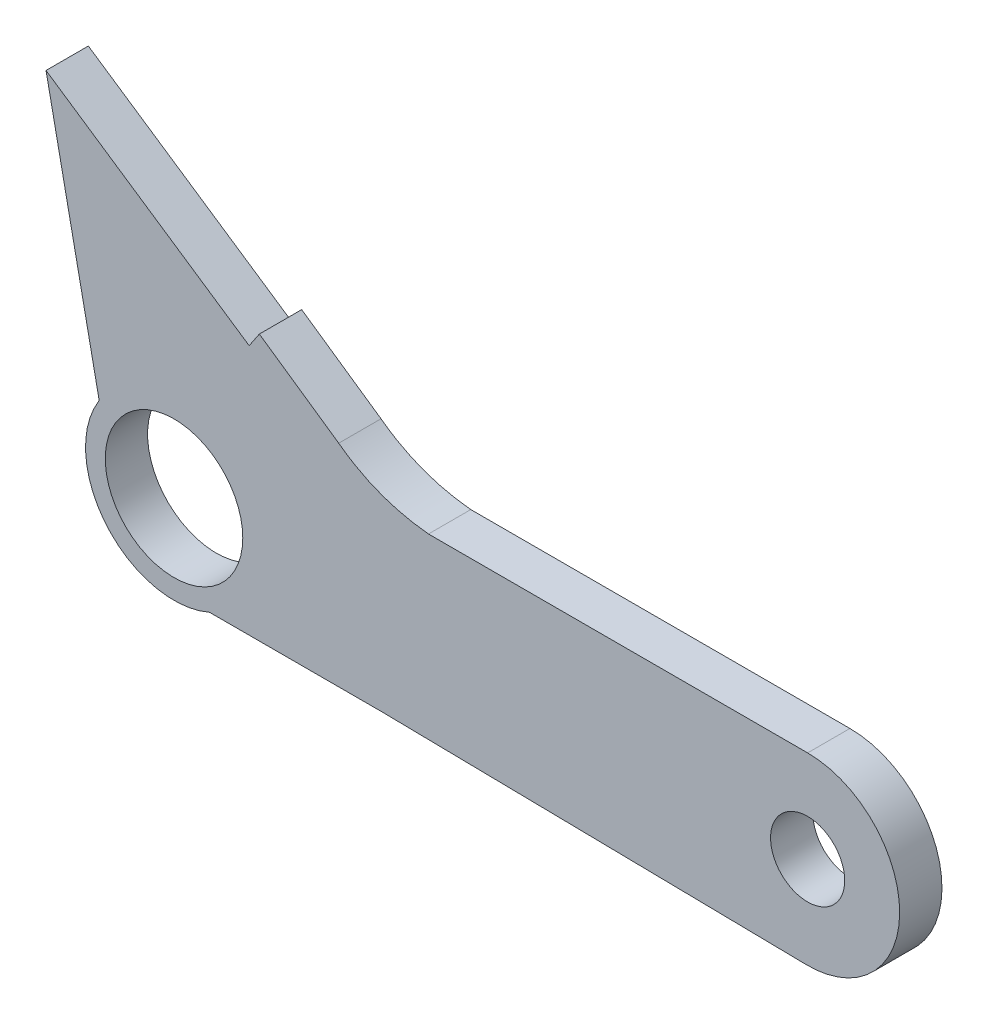
from build123d import *

# Parameters (mm, degrees)
SKETCH1_R           = 1.752344144
SKETCH1_R_2         = 3.25
BOSS_EXTRUDE1_DEPTH = 2
SCALE6_SCALE        = 2.8


with BuildPart() as part:
    # Sketch1 → Boss-Extrude1 (new body)
    with BuildSketch(Plane.XY):
        with BuildLine():
            Line((-201.779102887, 38.968850302), (-183.856871997, 38.968850302))
            ThreePointArc((-183.856871997, 38.968850302), (-179.50647719, 34.548425149), (-183.995805524, 30.26917))
            Line((-183.995805524, 30.26917), (-203.942326715, 30.587715102))
            Line((-203.942326715, 30.587715102), (-212.128411179, 30.587715102))
            ThreePointArc((-212.128411179, 30.587715102), (-216.977472251, 31.690715611), (-217.344366931, 36.650089735))
            Line((-217.344366931, 36.650089735), (-219.856871997, 48.906588317))
            Line((-219.856871997, 48.906588317), (-210.255760435, 42.440195681))
            Line((-210.255760435, 42.440195681), (-209.773273317, 43.15651595))
            Line((-209.773273317, 43.15651595), (-206.022177555, 40.564020545))
            add(Edge.make_bspline(
                [(-206.022177555, 40.564020545), (-204.845604067, 39.682708979), (-203.443834564, 39.1324171), (-201.779102887, 38.968850302)],
                knots=[0.24, 0.24, 0.24, 0.24, 0.28, 0.28, 0.28, 0.28], degree=3))
        make_face()
        with Locations((-183.856871997, 34.61790077)):
            Circle(SKETCH1_R, mode=Mode.SUBTRACT)
        with Locations((-213.807007526, 34.418525211)):
            Circle(SKETCH1_R_2, mode=Mode.SUBTRACT)
    extrude(amount=BOSS_EXTRUDE1_DEPTH)


with BuildPart() as part_1:
    # Scale6: scaled about (-200.816753652, 36.262830965, 1)
    add(part.part.scale(SCALE6_SCALE).moved(Location((361.470156574, -65.273095737, -1.8))))


solid = part_1.part
